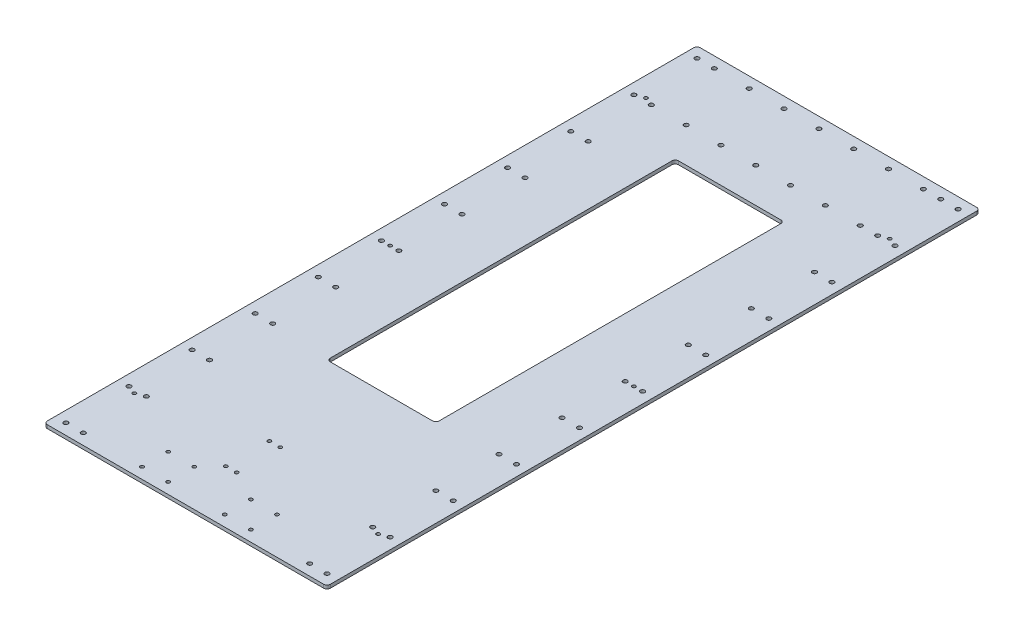
from build123d import *

# Parameters (mm, degrees)
SKETCH1_W           = 260
SKETCH1_H           = 600
SKETCH1_R           = 2
SKETCH1_R_2         = 1.6
SKETCH1_W_2         = 100
SKETCH1_H_2         = 320
BOSS_EXTRUDE1_DEPTH = 3.175
FILLET1_R           = 3


with BuildPart() as part:
    # Sketch1 → Boss-Extrude1 (new body)
    with BuildSketch(Plane(origin=(0, 0, 0), x_dir=(1, 0, 0), z_dir=(0, 1, 0))):
        Rectangle(SKETCH1_W, SKETCH1_H)
        with Locations(Location((120, 290, 0), (0, 0, 270))):
            Circle(SKETCH1_R, mode=Mode.SUBTRACT)
        with Locations(Location((120, 232, 0), (0, 0, 270))):
            Circle(SKETCH1_R, mode=Mode.SUBTRACT)
        with Locations(Location((120, 174, 0), (0, 0, 270))):
            Circle(SKETCH1_R, mode=Mode.SUBTRACT)
        with Locations(Location((120, 116, 0), (0, 0, 270))):
            Circle(SKETCH1_R, mode=Mode.SUBTRACT)
        with Locations(Location((120, 58, 0), (0, 0, 270))):
            Circle(SKETCH1_R, mode=Mode.SUBTRACT)
        with Locations(Location((120, 0, 0), (0, 0, 270))):
            Circle(SKETCH1_R, mode=Mode.SUBTRACT)
        with Locations(Location((120, -58, 0), (0, 0, 270))):
            Circle(SKETCH1_R, mode=Mode.SUBTRACT)
        with Locations(Location((120, -116, 0), (0, 0, 270))):
            Circle(SKETCH1_R, mode=Mode.SUBTRACT)
        with Locations(Location((120, -174, 0), (0, 0, 270))):
            Circle(SKETCH1_R, mode=Mode.SUBTRACT)
        with Locations(Location((120, -232, 0), (0, 0, 270))):
            Circle(SKETCH1_R, mode=Mode.SUBTRACT)
        with Locations(Location((120, -290, 0), (0, 0, 270))):
            Circle(SKETCH1_R, mode=Mode.SUBTRACT)
        with Locations(Location((-120, 232, 0), (0, 0, 90))):
            Circle(SKETCH1_R, mode=Mode.SUBTRACT)
        with Locations(Location((-120, -290, 0), (0, 0, 90))):
            Circle(SKETCH1_R, mode=Mode.SUBTRACT)
        with Locations(Location((-120, -232, 0), (0, 0, 90))):
            Circle(SKETCH1_R, mode=Mode.SUBTRACT)
        with Locations(Location((-120, -174, 0), (0, 0, 90))):
            Circle(SKETCH1_R, mode=Mode.SUBTRACT)
        with Locations(Location((-120, -116, 0), (0, 0, 90))):
            Circle(SKETCH1_R, mode=Mode.SUBTRACT)
        with Locations(Location((-120, -58, 0), (0, 0, 90))):
            Circle(SKETCH1_R, mode=Mode.SUBTRACT)
        with Locations(Location((-120, 0, 0), (0, 0, 90))):
            Circle(SKETCH1_R, mode=Mode.SUBTRACT)
        with Locations(Location((-120, 58, 0), (0, 0, 90))):
            Circle(SKETCH1_R, mode=Mode.SUBTRACT)
        with Locations(Location((-120, 116, 0), (0, 0, 90))):
            Circle(SKETCH1_R, mode=Mode.SUBTRACT)
        with Locations(Location((-120, 174, 0), (0, 0, 90))):
            Circle(SKETCH1_R, mode=Mode.SUBTRACT)
        with Locations(Location((-120, 290, 0), (0, 0, 90))):
            Circle(SKETCH1_R, mode=Mode.SUBTRACT)
        with Locations(Location((112, 235, 0), (0, 0, 270))):
            Circle(SKETCH1_R_2, mode=Mode.SUBTRACT)
        with Locations(Location((-112, 235, 0), (0, 0, 90))):
            Circle(SKETCH1_R_2, mode=Mode.SUBTRACT)
        with Locations(Location((112, -235, 0), (0, 0, 90))):
            Circle(SKETCH1_R_2, mode=Mode.SUBTRACT)
        with Locations(Location((-112, -235, 0), (0, 0, 270))):
            Circle(SKETCH1_R_2, mode=Mode.SUBTRACT)
        with Locations(Location((104, 290, 0), (0, 0, 270))):
            Circle(SKETCH1_R, mode=Mode.SUBTRACT)
        with Locations(Location((104, 232, 0), (0, 0, 270))):
            Circle(SKETCH1_R, mode=Mode.SUBTRACT)
        with Locations(Location((104, 174, 0), (0, 0, 270))):
            Circle(SKETCH1_R, mode=Mode.SUBTRACT)
        with Locations(Location((104, 116, 0), (0, 0, 270))):
            Circle(SKETCH1_R, mode=Mode.SUBTRACT)
        with Locations(Location((104, 58, 0), (0, 0, 270))):
            Circle(SKETCH1_R, mode=Mode.SUBTRACT)
        with Locations(Location((104, 0, 0), (0, 0, 270))):
            Circle(SKETCH1_R, mode=Mode.SUBTRACT)
        with Locations(Location((104, -58, 0), (0, 0, 270))):
            Circle(SKETCH1_R, mode=Mode.SUBTRACT)
        with Locations(Location((104, -116, 0), (0, 0, 270))):
            Circle(SKETCH1_R, mode=Mode.SUBTRACT)
        with Locations(Location((104, -174, 0), (0, 0, 270))):
            Circle(SKETCH1_R, mode=Mode.SUBTRACT)
        with Locations(Location((104, -232, 0), (0, 0, 270))):
            Circle(SKETCH1_R, mode=Mode.SUBTRACT)
        with Locations(Location((104, -290, 0), (0, 0, 270))):
            Circle(SKETCH1_R, mode=Mode.SUBTRACT)
        with Locations(Location((-104, -290, 0), (0, 0, 90))):
            Circle(SKETCH1_R, mode=Mode.SUBTRACT)
        with Locations(Location((-104, -174, 0), (0, 0, 90))):
            Circle(SKETCH1_R, mode=Mode.SUBTRACT)
        with Locations(Location((-104, -116, 0), (0, 0, 90))):
            Circle(SKETCH1_R, mode=Mode.SUBTRACT)
        with Locations(Location((-104, -58, 0), (0, 0, 90))):
            Circle(SKETCH1_R, mode=Mode.SUBTRACT)
        with Locations(Location((-104, 0, 0), (0, 0, 90))):
            Circle(SKETCH1_R, mode=Mode.SUBTRACT)
        with Locations(Location((-104, 58, 0), (0, 0, 90))):
            Circle(SKETCH1_R, mode=Mode.SUBTRACT)
        with Locations(Location((-104, 116, 0), (0, 0, 90))):
            Circle(SKETCH1_R, mode=Mode.SUBTRACT)
        with Locations(Location((-104, 174, 0), (0, 0, 90))):
            Circle(SKETCH1_R, mode=Mode.SUBTRACT)
        with Locations(Location((-104, 232, 0), (0, 0, 90))):
            Circle(SKETCH1_R, mode=Mode.SUBTRACT)
        with Locations(Location((-104, 290, 0), (0, 0, 90))):
            Circle(SKETCH1_R, mode=Mode.SUBTRACT)
        with Locations(Location((-104, -232, 0), (0, 0, 90))):
            Circle(SKETCH1_R, mode=Mode.SUBTRACT)
        with Locations(Location((112, 0, 0), (0, 0, 270))):
            Circle(SKETCH1_R_2, mode=Mode.SUBTRACT)
        with Locations(Location((-112, 0, 0), (0, 0, 90))):
            Circle(SKETCH1_R_2, mode=Mode.SUBTRACT)
        with Locations(Location((-50, -290, 0), (0, 0, 270))):
            Circle(SKETCH1_R_2, mode=Mode.SUBTRACT)
        with Locations(Location((-50, -266, 0), (0, 0, 270))):
            Circle(SKETCH1_R_2, mode=Mode.SUBTRACT)
        with Locations(Location((50, -266, 0), (0, 0, 90))):
            Circle(SKETCH1_R_2, mode=Mode.SUBTRACT)
        with Locations(Location((50, -290, 0), (0, 0, 90))):
            Circle(SKETCH1_R_2, mode=Mode.SUBTRACT)
        with Locations(Location((-26, -290, 0), (0, 0, 90))):
            Circle(SKETCH1_R_2, mode=Mode.SUBTRACT)
        with Locations(Location((-26, -266, 0), (0, 0, 90))):
            Circle(SKETCH1_R_2, mode=Mode.SUBTRACT)
        with Locations(Location((26, -290, 0), (0, 0, 270))):
            Circle(SKETCH1_R_2, mode=Mode.SUBTRACT)
        with Locations(Location((26, -266, 0), (0, 0, 270))):
            Circle(SKETCH1_R_2, mode=Mode.SUBTRACT)
        with Locations(Location((-72, 290, 0), (0, 0, 90))):
            Circle(SKETCH1_R, mode=Mode.SUBTRACT)
        with Locations(Location((-72, 232, 0), (0, 0, 90))):
            Circle(SKETCH1_R, mode=Mode.SUBTRACT)
        with Locations(Location((-40, 290, 0), (0, 0, 90))):
            Circle(SKETCH1_R, mode=Mode.SUBTRACT)
        with Locations(Location((-40, 232, 0), (0, 0, 90))):
            Circle(SKETCH1_R, mode=Mode.SUBTRACT)
        with Locations(Location((-8, 290, 0), (0, 0, 90))):
            Circle(SKETCH1_R, mode=Mode.SUBTRACT)
        with Locations(Location((-8, 232, 0), (0, 0, 90))):
            Circle(SKETCH1_R, mode=Mode.SUBTRACT)
        with Locations(Location((24, 290, 0), (0, 0, 90))):
            Circle(SKETCH1_R, mode=Mode.SUBTRACT)
        with Locations(Location((24, 232, 0), (0, 0, 90))):
            Circle(SKETCH1_R, mode=Mode.SUBTRACT)
        with Locations(Location((56, 290, 0), (0, 0, 90))):
            Circle(SKETCH1_R, mode=Mode.SUBTRACT)
        with Locations(Location((56, 232, 0), (0, 0, 90))):
            Circle(SKETCH1_R, mode=Mode.SUBTRACT)
        with Locations(Location((88, 290, 0), (0, 0, 90))):
            Circle(SKETCH1_R, mode=Mode.SUBTRACT)
        with Locations(Location((88, 232, 0), (0, 0, 90))):
            Circle(SKETCH1_R, mode=Mode.SUBTRACT)
        with Locations(Location((-12, -251, 0), (0, 0, 270))):
            Circle(SKETCH1_R_2, mode=Mode.SUBTRACT)
        with Locations(Location((-2, -251, 0), (0, 0, 270))):
            Circle(SKETCH1_R_2, mode=Mode.SUBTRACT)
        with Locations(Location((-12, -211, 0), (0, 0, 90))):
            Circle(SKETCH1_R_2, mode=Mode.SUBTRACT)
        with Locations(Location((-2, -211, 0), (0, 0, 90))):
            Circle(SKETCH1_R_2, mode=Mode.SUBTRACT)
        with Locations((0, 40)):
            Rectangle(SKETCH1_W_2, SKETCH1_H_2, mode=Mode.SUBTRACT)
    extrude(amount=BOSS_EXTRUDE1_DEPTH)

    # Fillet1
    fillet1_edges = [part.edges().sort_by_distance(p)[0] for p in [
        (50, 1.5875, 120),
        (50, 1.5875, -200),
        (-50, 1.5875, -200),
        (-50, 1.5875, 120),
        (130, 1.5875, 300),
        (-130, 1.5875, 300),
        (-130, 1.5875, -300),
        (130, 1.5875, -300),
    ]]
    fillet(fillet1_edges, radius=FILLET1_R)


solid = part.part
